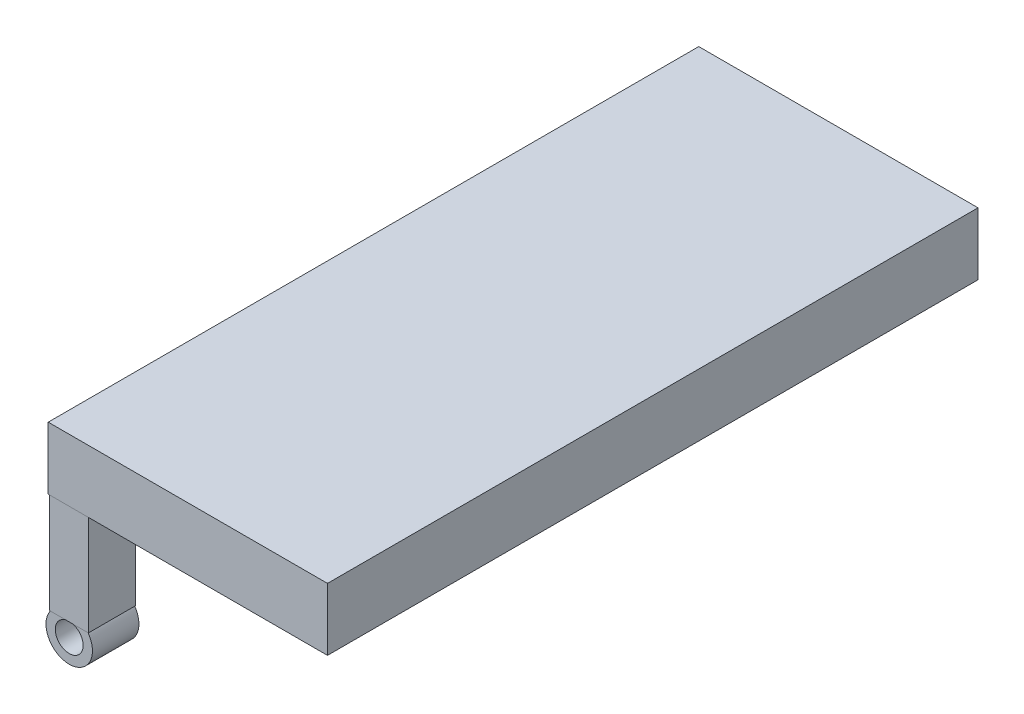
from build123d import *

# Parameters (mm, degrees)
SKETCH_1_R           = 5
EXTRUDE_1_DEPTH      = 10
SKETCH_2_R           = 3
CUT_EXTRUDE_1_DEPTH  = 8
EXTRUDE_2_DEPTH      = 0.1
EXTRUDE_2_DEPTH_BACK = 10
SKETCH_4_W           = 8.393953891
SKETCH_4_H           = 2.961503145
SKETCH_5_W           = 8.393953891
SKETCH_5_H           = 10.1
EXTRUDE_3_DEPTH      = 30
EXTRUDE_4_DEPTH      = 0.1
EXTRUDE_4_DEPTH_BACK = 60
SKETCH_6_W           = 140
SKETCH_6_H           = 13.422298932


with BuildPart() as part:
    # 草图1 → 凸台-拉伸1 (new body)
    with BuildSketch(Plane.XY):
        Circle(SKETCH_1_R)
    extrude(amount=EXTRUDE_1_DEPTH)

    # 草图2 → 切除-拉伸1 (cut)
    with BuildSketch(Plane.XY.offset(10)):
        Circle(SKETCH_2_R)
    extrude(amount=-CUT_EXTRUDE_1_DEPTH, mode=Mode.SUBTRACT)

    # 草图4 → 凸台-拉伸2 (add, two sides: drawn at the far end of the back side and taken through both)
    with BuildSketch(Plane.XY.offset(10).offset(-EXTRUDE_2_DEPTH_BACK)):
        with Locations((0.020379312, 4.475569238)):
            Rectangle(SKETCH_4_W, SKETCH_4_H)
    extrude(amount=EXTRUDE_2_DEPTH + EXTRUDE_2_DEPTH_BACK)

    # 草图5 → 凸台-拉伸3 (add)
    with BuildSketch(Plane(origin=(0, 5.95632081, 0), x_dir=(1, 0, 0), z_dir=(0, 1, 0))):
        with Locations((0.020379312, -5.05)):
            Rectangle(SKETCH_5_W, SKETCH_5_H)
    extrude(amount=EXTRUDE_3_DEPTH)

    # 草图6 → 凸台-拉伸4 (add, two sides: drawn at the far end of the back side and taken through both)
    with BuildSketch(Plane.ZY.offset(4.176597634).offset(-EXTRUDE_4_DEPTH_BACK)):
        with Locations((-59.754924963, 31.401268081)):
            Rectangle(SKETCH_6_W, SKETCH_6_H)
    extrude(amount=EXTRUDE_4_DEPTH + EXTRUDE_4_DEPTH_BACK)


solid = part.part
